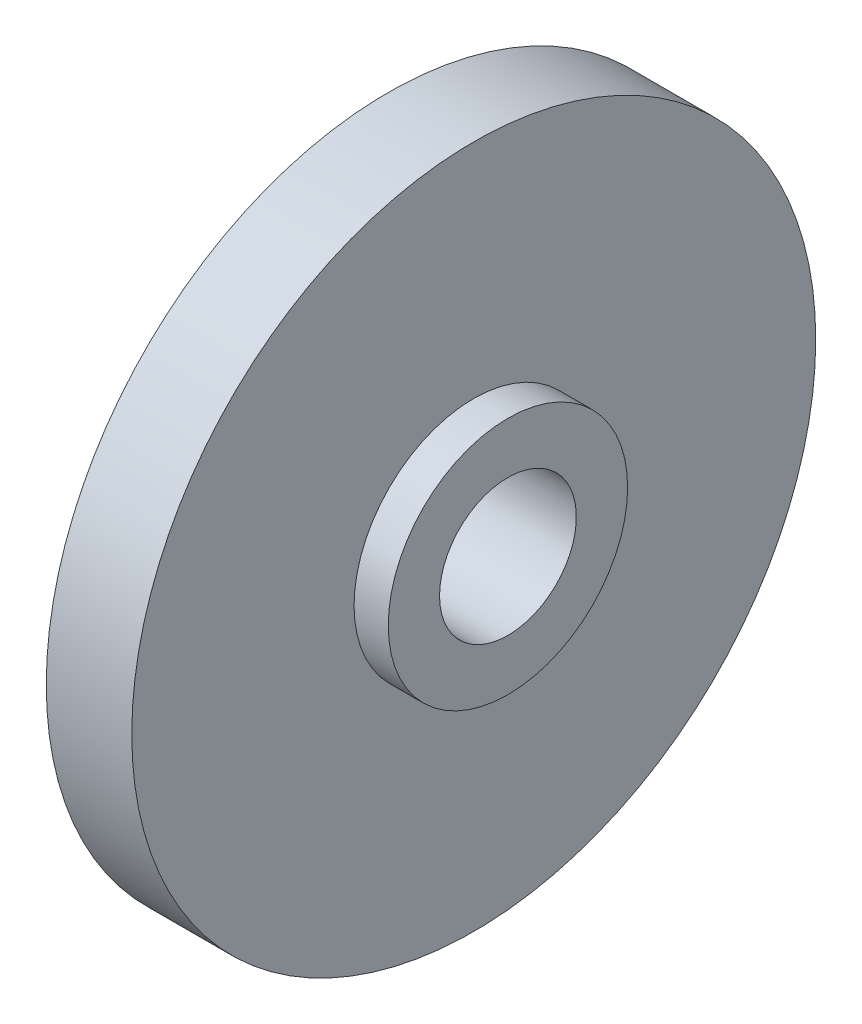
from build123d import *


with BuildPart() as part:
    # Esquisse1 → Révolution1 (revolve)
    with BuildSketch(Plane.XY, mode=Mode.PRIVATE) as r_volution1_sk:
        Polygon((0, 5.746678801), (0, 20), (5, 20), (5, 7), (7, 7), (7, 4), (0, 4), align=None)
    revolve(r_volution1_sk.sketch.rotate(Axis((0, 0, 0), (1, 0, 0)), 90), axis=Axis((0, 0, 0), (1, 0, 0)))


solid = part.part
